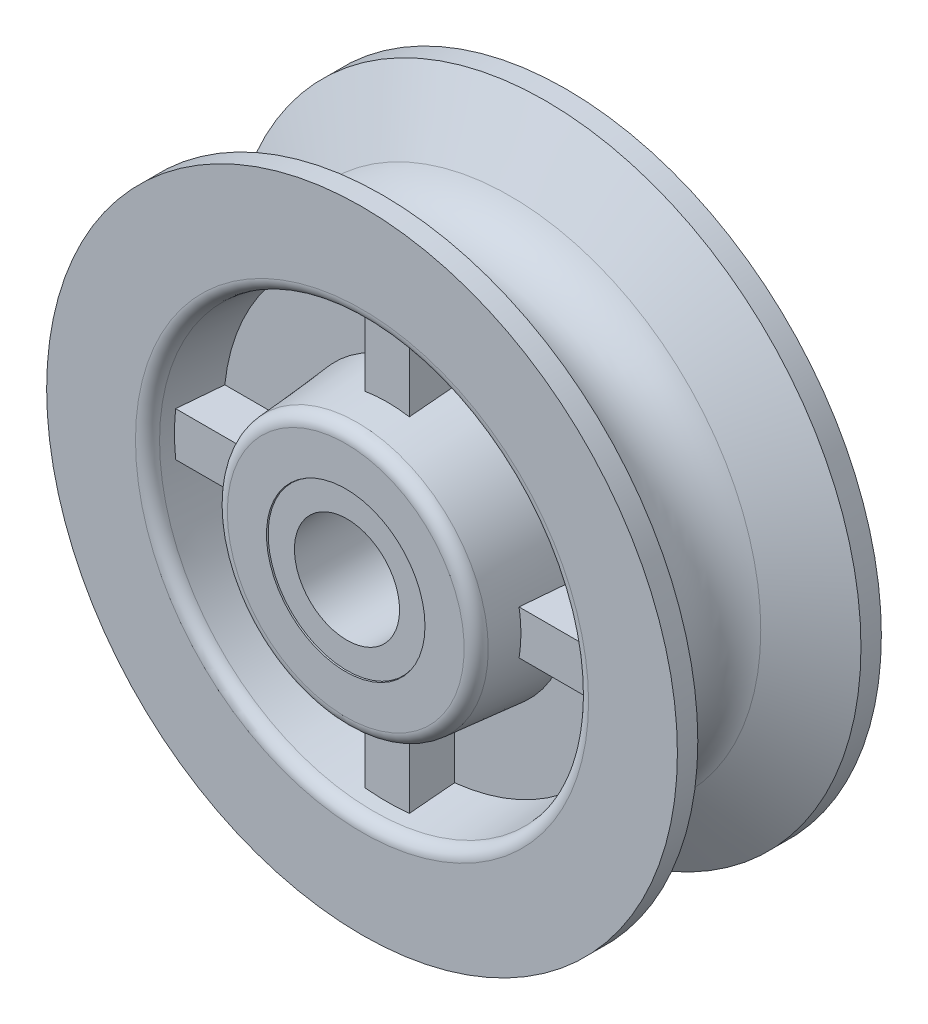
from build123d import *

# Parameters (mm, degrees)
CUT_EXTRUDE_THIN1_DEPTH      = 28.871816662
CUT_EXTRUDE_THIN1_DEPTH_BACK = 28.871816662
SKETCH2_R                    = 4.7879
SKETCH2_R_2                  = 4.7625
DRAFT1_ANGLE                 = 5
DRAFT2_ANGLE                 = 15
FILLET1_R                    = 0.762
SKETCH4_W                    = 2.667
SKETCH4_H                    = 8.22325
EXTRUDE_THIN1_DEPTH          = 4.6355
CIRPATTERN1_COUNT            = 4


with BuildPart() as part:
    # Sketch1 → Revolve1 (revolve)
    with BuildSketch(Plane(origin=(0, 0, 0), x_dir=(0, 0, -1), z_dir=(1, 0, 0)), mode=Mode.PRIVATE) as revolve1_sk:
        with BuildLine():
            Line((4.9276, 19.05), (6.1595, 19.05))
            Line((6.1595, 19.05), (6.1595, 12.98575))
            Line((6.1595, 12.98575), (1.905, 12.98575))
            Line((1.905, 12.98575), (1.905, 7.9375))
            Line((1.905, 7.9375), (7.14375, 7.9375))
            Line((7.14375, 7.9375), (7.14375, 4.7625))
            Line((7.14375, 4.7625), (7.06755, 4.7625))
            Line((7.06755, 4.7625), (7.06755, 3.175))
            Line((7.06755, 3.175), (-7.06755, 3.175))
            Line((-7.06755, 3.175), (-7.06755, 4.7625))
            Line((-7.06755, 4.7625), (-7.14375, 4.7625))
            Line((-7.14375, 4.7625), (-7.14375, 7.9375))
            Line((-7.14375, 7.9375), (-1.905, 7.9375))
            Line((-1.905, 7.9375), (-1.905, 12.98575))
            Line((-1.905, 12.98575), (-6.1595, 12.98575))
            Line((-6.1595, 12.98575), (-6.1595, 19.05))
            Line((-6.1595, 19.05), (-4.9276, 19.05))
            Line((-4.9276, 19.05), (-2.783674505, 15.141732891))
            ThreePointArc((-2.783674505, 15.141732891), (0, 13.49375), (2.783674505, 15.141732891))
            Line((2.783674505, 15.141732891), (4.9276, 19.05))
        make_face()
    revolve(revolve1_sk.sketch.rotate(Axis((0, 0, 7.14375), (0, 0, -1)), 90), axis=Axis((0, 0, 7.14375), (0, 0, -1)))

    # Sketch2 → Cut-Extrude-Thin1 (cut, two sides: drawn at the far end of the back side and taken through both)
    with BuildSketch(Plane.XY.offset(-CUT_EXTRUDE_THIN1_DEPTH_BACK)):
        Circle(SKETCH2_R)
        Circle(SKETCH2_R_2, mode=Mode.SUBTRACT)
    extrude(amount=CUT_EXTRUDE_THIN1_DEPTH + CUT_EXTRUDE_THIN1_DEPTH_BACK, mode=Mode.SUBTRACT)


with BuildPart() as cut_extrude_thin1_piece_1:
    # of the separate pieces the step leaves, piece 1, a body of its own (cut_extrude_thin1_pieces)
    add(part.part.solids().sort_by_distance((15.141732891, 0, -2.783674505))[0])

    # Draft1
    draft1_faces = [cut_extrude_thin1_piece_1.faces().sort_by_distance(p)[0] for p in [
        (-7.9375, 0, 4.524375),
        (-12.98575, 0, 4.03225),
    ]]
    draft(draft1_faces, Plane(origin=(0, 12.98575, 6.1595), x_dir=(1, 0, 0), z_dir=(0, 0, 1)), DRAFT1_ANGLE)

    # Draft2
    draft2_faces = [cut_extrude_thin1_piece_1.faces().sort_by_distance(p)[0] for p in [
        (-7.9375, 0, -4.524375),
        (-12.98575, 0, -4.03225),
    ]]
    draft(draft2_faces, Plane(origin=(0, 19.05, -6.1595), x_dir=(-1, 0, 0), z_dir=(0, 0, -1)), DRAFT2_ANGLE)

    # Fillet1
    fillet1_edges = [cut_extrude_thin1_piece_1.edges().sort_by_distance(p)[0] for p in [
        (-12.98575, 0, 6.1595),
        (-7.851389283, 0, 7.14375),
        (-7.673771007, 0, -7.14375),
        (-12.98575, 0, -6.1595),
    ]]
    fillet(fillet1_edges, radius=FILLET1_R)



with BuildPart() as cut_extrude_thin1_piece_2:
    # of the separate pieces the step leaves, piece 2, a body of its own (cut_extrude_thin1_pieces)
    add(part.part.solids().sort_by_distance((4.7625, 0, -7.06755))[0])


with BuildPart() as cut_extrude_thin1_piece_1_1:
    add(cut_extrude_thin1_piece_1.part)

    add(cut_extrude_thin1_piece_2.part)  # Extrude-Thin1 merges Cut-Extrude-Thin1 piece 2
    # Sketch4 → Extrude-Thin1 (add, symmetric)
    with BuildSketch(Plane.XY):
        with Locations((0, 8.874125)):
            Rectangle(SKETCH4_W, SKETCH4_H)
    extrude_thin1 = extrude(amount=EXTRUDE_THIN1_DEPTH, both=True)

    # CirPattern1: Extrude-Thin1 ×4 about axis
    cirpattern1_axis = Axis((0, 0, 0), (0, 0, 1))
    for i in range(1, CIRPATTERN1_COUNT):
        add(extrude_thin1.rotate(cirpattern1_axis, i * 360 / CIRPATTERN1_COUNT))


solid = cut_extrude_thin1_piece_1_1.part
